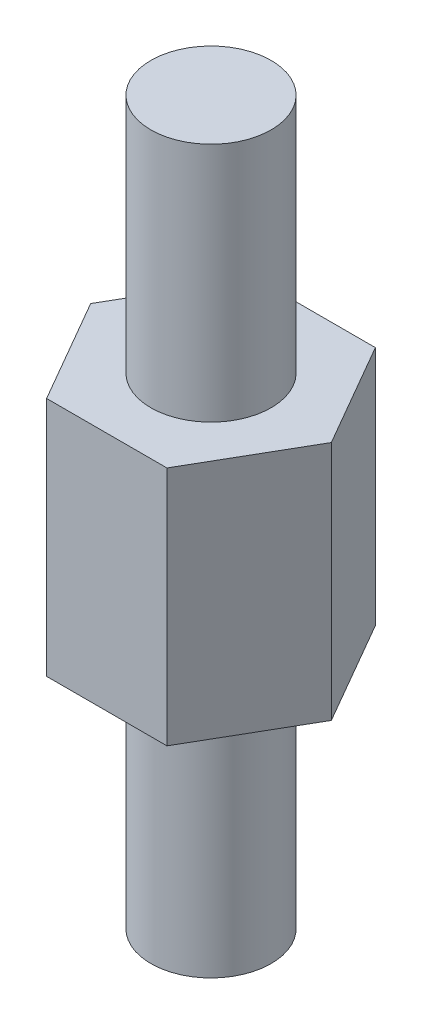
from build123d import *

# Parameters (mm, degrees)
EXTRUDE_1_DEPTH = 6
SKETCH_2_R      = 1.5
EXTRUDE_2_DEPTH = 6
EXTRUDE_START   = 6
SKETCH_3_R      = 1.5
EXTRUDE_3_DEPTH = 6


with BuildPart() as part:
    # 草图1 → 凸台-拉伸1 (new body)
    with BuildSketch(Plane(origin=(0, 0, 0), x_dir=(1, 0, 0), z_dir=(0, 1, 0))):
        Polygon((3, 0), (1.5, 2.598076211), (-1.5, 2.598076211), (-3, 0), (-1.5, -2.598076211), (1.5, -2.598076211), align=None)
    extrude(amount=EXTRUDE_1_DEPTH)

    # 草图2 → 凸台-拉伸2 (add)
    with BuildSketch(Plane(origin=(0, 6, 0), x_dir=(1, 0, 0), z_dir=(0, 1, 0))):
        with Locations(Location((0, 0, 0), (0, 0, 270))):
            Circle(SKETCH_2_R)
    extrude(amount=EXTRUDE_2_DEPTH)

    # 草图3 → 凸台-拉伸3 (add)
    with BuildSketch(Plane.XZ.offset(EXTRUDE_START)):
        with Locations(Location((0, 0, 0), (0, 0, 90))):
            Circle(SKETCH_3_R)
    extrude(amount=-EXTRUDE_3_DEPTH)


solid = part.part
